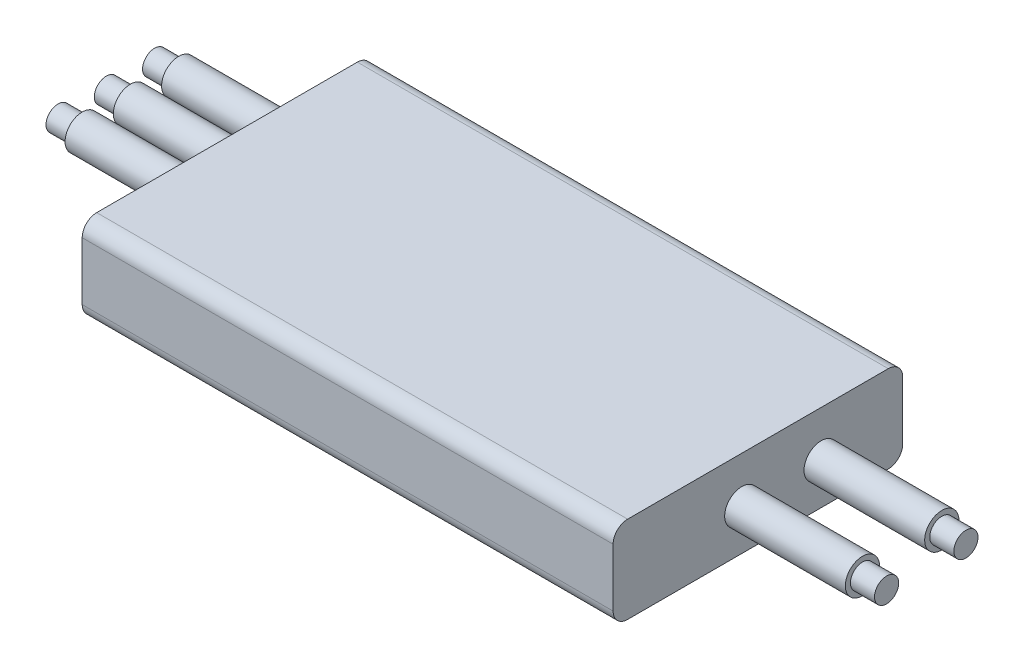
from build123d import *

# Parameters (mm, degrees)
SKETCH1_W           = 110
SKETCH1_H           = 60
BOSS_EXTRUDE1_DEPTH = 18
FILLET1_R           = 3
SKETCH2_R           = 3.55
BOSS_EXTRUDE2_DEPTH = 25
SKETCH3_R           = 3.55
BOSS_EXTRUDE3_DEPTH = 25
SKETCH4_R           = 2.5
BOSS_EXTRUDE4_DEPTH = 5
SKETCH5_R           = 2.5
BOSS_EXTRUDE5_DEPTH = 5


with BuildPart() as part:
    # Sketch1 → Boss-Extrude1 (new body)
    with BuildSketch(Plane(origin=(0, 0, 0), x_dir=(1, 0, 0), z_dir=(0, 1, 0))):
        Rectangle(SKETCH1_W, SKETCH1_H)
    extrude(amount=BOSS_EXTRUDE1_DEPTH)

    # Fillet1
    fillet1_edges = [part.edges().sort_by_distance(p)[0] for p in [
        (0, 18, 30),
        (0, 0, 30),
        (0, 0, -30),
        (0, 18, -30),
    ]]
    fillet(fillet1_edges, radius=FILLET1_R)

    # Sketch2 → Boss-Extrude2 (add)
    with BuildSketch(Plane(origin=(55, 0, 0), x_dir=(0, 0, -1), z_dir=(1, 0, 0))):
        with Locations(Location((13.090661553, 8.467313241, 0), (0, 0, 180))):
            Circle(SKETCH2_R)
        with Locations(Location((-3.345586855, 8.467313241, 0), (0, 0, 180))):
            Circle(SKETCH2_R)
    extrude(amount=BOSS_EXTRUDE2_DEPTH)

    # Sketch3 → Boss-Extrude3 (add)
    with BuildSketch(Plane.ZY.offset(55)):
        with Locations(Location((-15, 9, 0), (0, 0, 180))):
            Circle(SKETCH3_R)
        with Locations(Location((5, 9, 0), (0, 0, 180))):
            Circle(SKETCH3_R)
        with Locations(Location((-5, 9, 0), (0, 0, 180))):
            Circle(SKETCH3_R)
    extrude(amount=BOSS_EXTRUDE3_DEPTH)

    # Sketch4 → Boss-Extrude4 (add)
    with BuildSketch(Plane.ZY.offset(80)):
        with Locations((-15, 9)):
            Circle(SKETCH4_R)
        with Locations((-5, 9)):
            Circle(SKETCH4_R)
        with Locations((5, 9)):
            Circle(SKETCH4_R)
    extrude(amount=BOSS_EXTRUDE4_DEPTH)

    # Sketch5 → Boss-Extrude5 (add)
    with BuildSketch(Plane(origin=(80, 0, 0), x_dir=(0, 0, -1), z_dir=(1, 0, 0))):
        with Locations((-3.345586855, 8.467313241)):
            Circle(SKETCH5_R)
        with Locations((13.090661553, 8.467313241)):
            Circle(SKETCH5_R)
    extrude(amount=BOSS_EXTRUDE5_DEPTH)


solid = part.part
